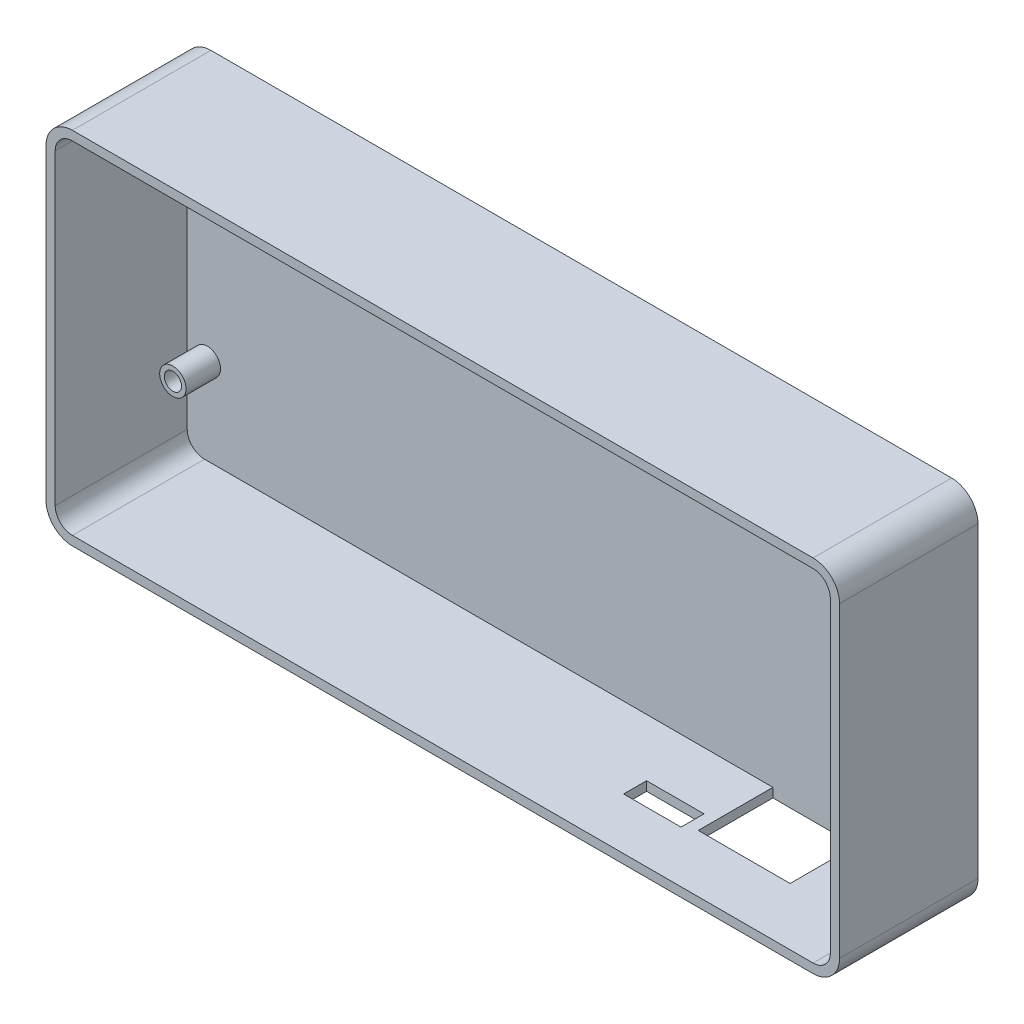
from build123d import *

# Parameters (mm, degrees)
PARED_DEPTH             = 23
CONECTORES_REACH        = 154.052
CROQUIS2_W              = 16
CROQUIS2_H              = 13
CROQUIS2_W_2            = 10
CROQUIS2_H_2            = 4
BASE_START              = -1.12
BASE_FRENTE_DEPTH       = 1.12
LUCES_REACH             = 153.399
CROQUIS3_R              = 1.5
CROQUIS3_R_2            = 2.5
SALIENTE_EXTRUIR1_START = 12
CROQUIS3_3_R            = 2.3
CROQUIS3_3_R_2          = 1.5
SALIENTE_EXTRUIR1_DEPTH = 12
SALIENTE_EXTRUIR2_START = 9
CROQUIS3_4_R            = 3.3
CROQUIS3_4_R_2          = 2.5
SALIENTE_EXTRUIR2_DEPTH = 9
SALIENTE_EXTRUIR3_START = 6
CROQUIS3_5_R            = 2.3
CROQUIS3_5_R_2          = 1.5
SALIENTE_EXTRUIR3_DEPTH = 6


with BuildPart() as part:
    # Croquis1 → pared (new body)
    with BuildSketch(Plane.XY):
        with BuildLine():
            Line((3, 61.1), (132, 61.1))
            ThreePointArc((132, 61.1), (135.252691193, 59.752691193), (136.6, 56.5))
            Line((136.6, 56.5), (136.6, 3))
            ThreePointArc((136.6, 3), (135.252691193, -0.252691193), (132, -1.6))
            Line((132, -1.6), (3, -1.6))
            ThreePointArc((3, -1.6), (-0.252691193, -0.252691193), (-1.6, 3))
            Line((-1.6, 3), (-1.6, 56.5))
            ThreePointArc((-1.6, 56.5), (-0.252691193, 59.752691193), (3, 61.1))
        make_face()
        with BuildLine():
            Line((3, 0), (132, 0))
            ThreePointArc((132, 0), (134.121320344, 0.878679656), (135, 3))
            Line((135, 3), (135, 56.5))
            ThreePointArc((135, 56.5), (134.121320344, 58.621320344), (132, 59.5))
            Line((132, 59.5), (3, 59.5))
            ThreePointArc((3, 59.5), (0.878679656, 58.621320344), (0, 56.5))
            Line((0, 56.5), (0, 3))
            ThreePointArc((0, 3), (0.878679656, 0.878679656), (3, 0))
        make_face(mode=Mode.SUBTRACT)
    extrude(amount=PARED_DEPTH)

    # Croquis2 → conectores (cut, up to next)
    with BuildSketch(Plane.XZ.offset(1.6), mode=Mode.PRIVATE) as conectores_sk1:
        with Locations((110, 6.5)):
            Rectangle(CROQUIS2_W, CROQUIS2_H)
    conectores_tool1 = extrude(conectores_sk1.sketch, amount=-CONECTORES_REACH, mode=Mode.PRIVATE) & part.part
    # Croquis2 → conectores (cut, up to next)
    with BuildSketch(Plane.XZ.offset(1.6), mode=Mode.PRIVATE) as conectores_sk2:
        with Locations((95, 12)):
            Rectangle(CROQUIS2_W_2, CROQUIS2_H_2)
    conectores_tool2 = extrude(conectores_sk2.sketch, amount=-CONECTORES_REACH, mode=Mode.PRIVATE) & part.part
    add(conectores_tool1.solids().sort_by_distance((110, -1.6, 6.5))[0], mode=Mode.SUBTRACT)
    add(conectores_tool2.solids().sort_by_distance((95, -1.6, 12))[0], mode=Mode.SUBTRACT)

    # Croquis1<2> → base frente (add)
    with BuildSketch(Plane.XY.offset(BASE_START)):
        with BuildLine():
            Line((3, 61.1), (132, 61.1))
            ThreePointArc((132, 61.1), (135.252691193, 59.752691193), (136.6, 56.5))
            Line((136.6, 56.5), (136.6, 3))
            ThreePointArc((136.6, 3), (135.252691193, -0.252691193), (132, -1.6))
            Line((132, -1.6), (3, -1.6))
            ThreePointArc((3, -1.6), (-0.252691193, -0.252691193), (-1.6, 3))
            Line((-1.6, 3), (-1.6, 56.5))
            ThreePointArc((-1.6, 56.5), (-0.252691193, 59.752691193), (3, 61.1))
        make_face()
    extrude(amount=BASE_FRENTE_DEPTH)

    # Croquis3 → luces (cut, up to next)
    with BuildSketch(Plane.XY, mode=Mode.PRIVATE) as luces_sk1:
        with Locations((130.5, 48)):
            Circle(CROQUIS3_R)
    luces_tool1 = extrude(luces_sk1.sketch, amount=-LUCES_REACH, mode=Mode.PRIVATE) & part.part
    # Croquis3 → luces (cut, up to next)
    with BuildSketch(Plane.XY, mode=Mode.PRIVATE) as luces_sk2:
        with Locations((130.5, 41.5)):
            Circle(CROQUIS3_R)
    luces_tool2 = extrude(luces_sk2.sketch, amount=-LUCES_REACH, mode=Mode.PRIVATE) & part.part
    # Croquis3 → luces (cut, up to next)
    with BuildSketch(Plane.XY, mode=Mode.PRIVATE) as luces_sk3:
        with Locations((130.5, 35)):
            Circle(CROQUIS3_R)
    luces_tool3 = extrude(luces_sk3.sketch, amount=-LUCES_REACH, mode=Mode.PRIVATE) & part.part
    # Croquis3 → luces (cut, up to next)
    with BuildSketch(Plane.XY, mode=Mode.PRIVATE) as luces_sk4:
        with Locations((130.5, 28.5)):
            Circle(CROQUIS3_R)
    luces_tool4 = extrude(luces_sk4.sketch, amount=-LUCES_REACH, mode=Mode.PRIVATE) & part.part
    # Croquis3 → luces (cut, up to next)
    with BuildSketch(Plane.XY, mode=Mode.PRIVATE) as luces_sk5:
        with Locations((130.5, 17.5)):
            Circle(CROQUIS3_R)
    luces_tool5 = extrude(luces_sk5.sketch, amount=-LUCES_REACH, mode=Mode.PRIVATE) & part.part
    # Croquis3 → luces (cut, up to next)
    with BuildSketch(Plane.XY, mode=Mode.PRIVATE) as luces_sk6:
        with Locations((130.5, 11.5)):
            Circle(CROQUIS3_R_2)
    luces_tool6 = extrude(luces_sk6.sketch, amount=-LUCES_REACH, mode=Mode.PRIVATE) & part.part
    # Croquis3 → luces (cut, up to next)
    with BuildSketch(Plane.XY, mode=Mode.PRIVATE) as luces_sk7:
        with Locations((3.5, 15)):
            Circle(CROQUIS3_R)
    luces_tool7 = extrude(luces_sk7.sketch, amount=-LUCES_REACH, mode=Mode.PRIVATE) & part.part
    add(luces_tool1.solids().sort_by_distance((130.5, 48, 0))[0], mode=Mode.SUBTRACT)
    add(luces_tool2.solids().sort_by_distance((130.5, 41.5, 0))[0], mode=Mode.SUBTRACT)
    add(luces_tool3.solids().sort_by_distance((130.5, 35, 0))[0], mode=Mode.SUBTRACT)
    add(luces_tool4.solids().sort_by_distance((130.5, 28.5, 0))[0], mode=Mode.SUBTRACT)
    add(luces_tool5.solids().sort_by_distance((130.5, 17.5, 0))[0], mode=Mode.SUBTRACT)
    add(luces_tool6.solids().sort_by_distance((130.5, 11.5, 0))[0], mode=Mode.SUBTRACT)
    add(luces_tool7.solids().sort_by_distance((3.5, 15, 0))[0], mode=Mode.SUBTRACT)

    # Croquis3<3> → Saliente-Extruir1 (add)
    # profile 1 of 5: a face of its own
    with BuildSketch(Plane.XY.offset(SALIENTE_EXTRUIR1_START)):
        with Locations((130.5, 48)):
            Circle(CROQUIS3_3_R)
        with Locations((130.5, 48)):
            Circle(CROQUIS3_3_R_2, mode=Mode.SUBTRACT)
    # profile 2 of 5: a face of its own
    with BuildSketch(Plane.XY.offset(SALIENTE_EXTRUIR1_START)):
        with Locations((130.5, 41.5)):
            Circle(CROQUIS3_3_R)
        with Locations((130.5, 41.5)):
            Circle(CROQUIS3_3_R_2, mode=Mode.SUBTRACT)
    # profile 3 of 5: a face of its own
    with BuildSketch(Plane.XY.offset(SALIENTE_EXTRUIR1_START)):
        with Locations((130.5, 35)):
            Circle(CROQUIS3_3_R)
        with Locations((130.5, 35)):
            Circle(CROQUIS3_3_R_2, mode=Mode.SUBTRACT)
    # profile 4 of 5: a face of its own
    with BuildSketch(Plane.XY.offset(SALIENTE_EXTRUIR1_START)):
        with Locations((130.5, 28.5)):
            Circle(CROQUIS3_3_R)
        with Locations((130.5, 28.5)):
            Circle(CROQUIS3_3_R_2, mode=Mode.SUBTRACT)
    # profile 5 of 5: a face of its own
    with BuildSketch(Plane.XY.offset(SALIENTE_EXTRUIR1_START)):
        with Locations((130.5, 17.5)):
            Circle(CROQUIS3_3_R)
        with Locations((130.5, 17.5)):
            Circle(CROQUIS3_3_R_2, mode=Mode.SUBTRACT)
    extrude(amount=-SALIENTE_EXTRUIR1_DEPTH)

    # Croquis3<4> → Saliente-Extruir2 (add)
    with BuildSketch(Plane.XY.offset(SALIENTE_EXTRUIR2_START)):
        with Locations((130.5, 11.5)):
            Circle(CROQUIS3_4_R)
        with Locations((130.5, 11.5)):
            Circle(CROQUIS3_4_R_2, mode=Mode.SUBTRACT)
    extrude(amount=-SALIENTE_EXTRUIR2_DEPTH)

    # Croquis3<5> → Saliente-Extruir3 (add)
    with BuildSketch(Plane.XY.offset(SALIENTE_EXTRUIR3_START)):
        with Locations((3.5, 15)):
            Circle(CROQUIS3_5_R)
        with Locations((3.5, 15)):
            Circle(CROQUIS3_5_R_2, mode=Mode.SUBTRACT)
    extrude(amount=-SALIENTE_EXTRUIR3_DEPTH)


solid = part.part
